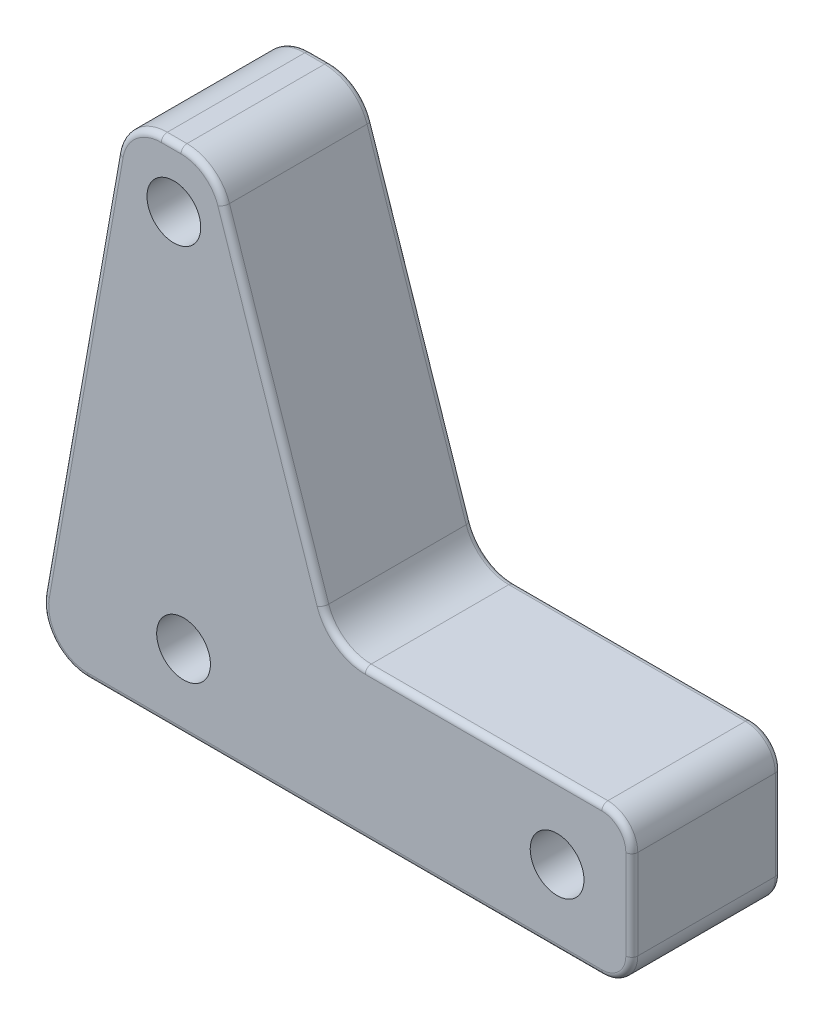
from build123d import *

# Parameters (mm, degrees)
SKETCH1_R           = 2.286
BOSS_EXTRUDE1_DEPTH = 12.7
FILLET2_R           = 3.81
FILLET3_R           = 2.54
SKETCH6_R           = 2.286
CUT_EXTRUDE4_DEPTH  = 68.870777217
FILLET4_R           = 0.508


with BuildPart() as part:
    # Sketch1 → Boss-Extrude1 (new body)
    with BuildSketch(Plane.XY):
        Polygon((7.613799027, 43.18), (0, 0), (50.8, 0), (50.8, 12.7), (25.4, 12.7), (15.233799027, 43.18), align=None)
        with Locations((11.876425153, 38.1)):
            Circle(SKETCH1_R, mode=Mode.SUBTRACT)
    extrude(amount=BOSS_EXTRUDE1_DEPTH)

    # Fillet2
    fillet2_edges = [part.edges().sort_by_distance(p)[0] for p in [
        (0, 0, 6.35),
        (7.613799027, 43.18, 6.35),
        (15.233799027, 43.18, 6.35),
        (25.4, 12.7, 6.35),
    ]]
    fillet(fillet2_edges, radius=FILLET2_R)

    # Fillet3
    fillet3_edges = [part.edges().sort_by_distance(p)[0] for p in [
        (50.8, 12.7, 6.35),
        (50.8, 0, 6.35),
    ]]
    fillet(fillet3_edges, radius=FILLET3_R)

    # Sketch6 → Cut-Extrude4 (cut, through all)
    with BuildSketch(Plane(origin=(0, 0, 0), x_dir=(-1, 0, 0), z_dir=(0, 0, -1))):
        with Locations((-44.45, 6.35)):
            Circle(SKETCH6_R)
        with Locations((-12.7, 6.35)):
            Circle(SKETCH6_R)
    extrude(amount=-CUT_EXTRUDE4_DEPTH, mode=Mode.SUBTRACT)

    # Fillet4
    fillet4_edges = [part.edges().sort_by_distance(p)[0] for p in [
        (11.64950248, 43.18, 0),
        (11.64950248, 43.18, 12.7),
        (26.400290594, 0, 0),
        (3.923557366, 22.251599557, 0),
        (20.316899513, 27.94, 0),
        (8.361747829, 42.288629328, 0),
        (1.62195186, 1.360979207, 0),
        (14.715699565, 42.46103665, 0),
        (20.316899513, 27.94, 12.7),
        (26.400290594, 0, 12.7),
        (3.923557366, 22.251599557, 12.7),
        (8.361747829, 42.288629328, 12.7),
        (1.62195186, 1.360979207, 12.7),
        (14.715699565, 42.46103665, 12.7),
        (25.918099462, 13.41896335, 0),
        (25.918099462, 13.41896335, 12.7),
        (50.8, 6.35, 0),
        (50.8, 6.35, 12.7),
        (38.202781345, 12.7, 0),
        (50.056051224, 11.956051224, 0),
        (50.056051224, 0.743948776, 0),
        (38.202781345, 12.7, 12.7),
        (50.056051224, 11.956051224, 12.7),
        (50.056051224, 0.743948776, 12.7),
    ]]
    fillet(fillet4_edges, radius=FILLET4_R)


solid = part.part
